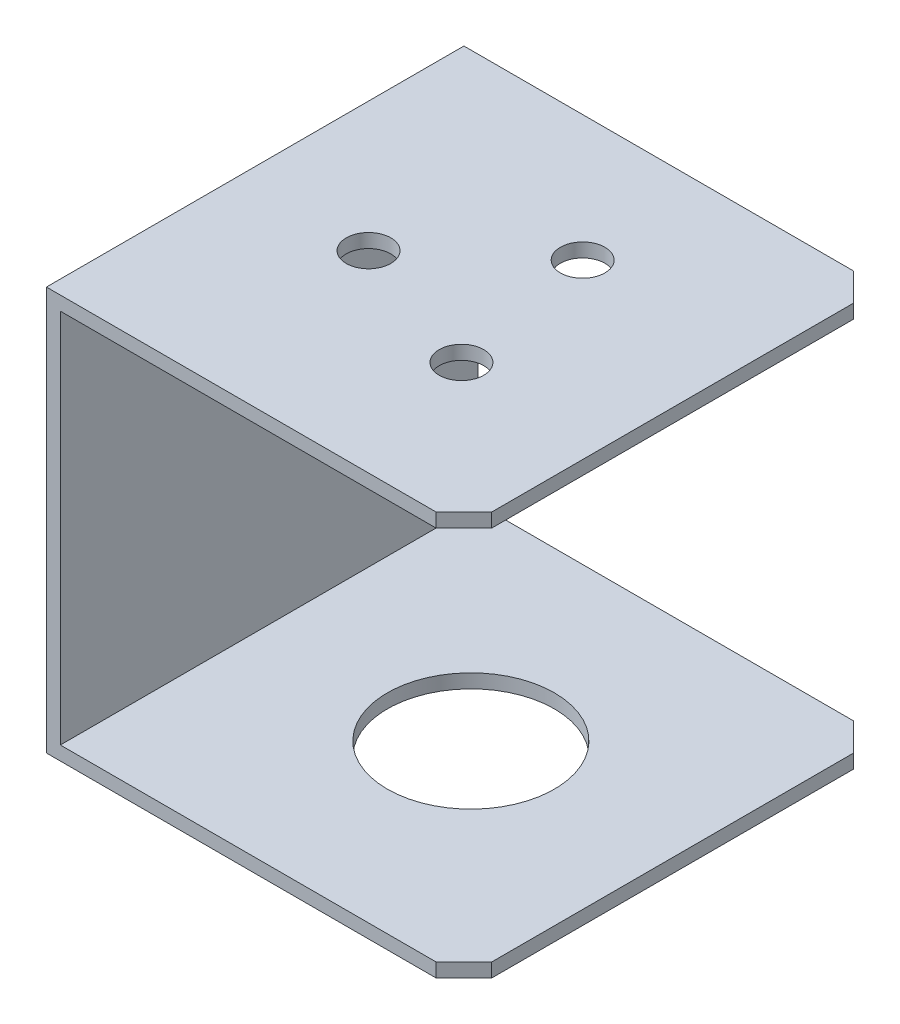
from build123d import *

# Parameters (mm, degrees)
BOSS_EXTRUDE1_DEPTH = 30
SKETCH3_R           = 1.6
CUT_EXTRUDE1_DEPTH  = 10
SKETCH2_R           = 6
CUT_EXTRUDE2_DEPTH  = 10
CHAMFER1_SIZE       = 2


with BuildPart() as part:
    # Sketch1 → Boss-Extrude1 (new body)
    with BuildSketch(Plane.XY):
        Polygon((0, 0), (30, 0), (30, 1), (1, 1), (1, 28), (30, 28), (30, 29), (0, 29), (0, 28), (0, 1), align=None)
    extrude(amount=BOSS_EXTRUDE1_DEPTH)

    # Sketch3 → Cut-Extrude1 (cut)
    with BuildSketch(Plane(origin=(0, 29, 0), x_dir=(1, 0, 0), z_dir=(0, 1, 0))):
        with Locations(Location((19.603232535, -19.78053164, 0), (0, 0, 270))):
            Circle(SKETCH3_R)
        with Locations(Location((9.308321888, -16.163237793, 0), (0, 0, 270))):
            Circle(SKETCH3_R)
        with Locations(Location((17.588445577, -9.056230567, 0), (0, 0, 270))):
            Circle(SKETCH3_R)
    extrude(amount=-CUT_EXTRUDE1_DEPTH, mode=Mode.SUBTRACT)

    # Sketch2 → Cut-Extrude2 (cut)
    with BuildSketch(Plane(origin=(0, 1, 0), x_dir=(1, 0, 0), z_dir=(0, 1, 0))):
        with Locations(Location((15.5, -15, 0), (0, 0, 270))):
            Circle(SKETCH2_R)
    extrude(amount=-CUT_EXTRUDE2_DEPTH, mode=Mode.SUBTRACT)

    # Chamfer1
    chamfer1_edges = [part.edges().sort_by_distance(p)[0] for p in [
        (30, 28.5, 0),
        (30, 0.5, 30),
        (30, 0.5, 0),
        (30, 28.5, 30),
    ]]
    chamfer(chamfer1_edges, length=CHAMFER1_SIZE)


solid = part.part
